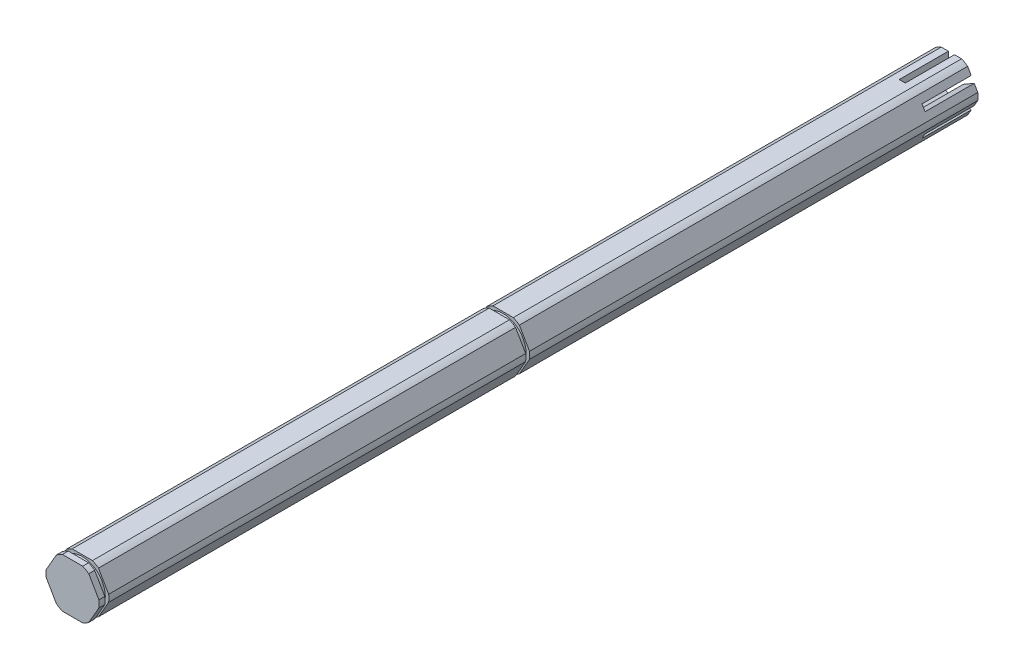
from build123d import *

# Parameters (mm, degrees)
SKETCH2_OUTSIDE_W   = 40.204
SKETCH2_OUTSIDE_H   = 40.204
CUT_EXTRUDE1_DEPTH  = 114.289694924
BOSS_EXTRUDE1_START = 114.3
SKETCH3_R           = 2.4892
BOSS_EXTRUDE1_DEPTH = 114.3
SKETCH4_R           = 3.175
CUT_EXTRUDE2_DEPTH  = 12.7
SKETCH5_W           = 1.5748
SKETCH5_H           = 12.7
CUT_EXTRUDE3_DEPTH  = 12.7
CIRPATTERN1_COUNT   = 6


with BuildPart() as part:
    # Sketch1 → Revolve3 (revolve)
    with BuildSketch(Plane(origin=(0, 0, 0), x_dir=(0, 0, -1), z_dir=(1, 0, 0)), mode=Mode.PRIVATE) as revolve3_sk:
        Polygon((111.252, 7.62), (112.776, 7.62), (112.776, 0), (0, 0), (0, 7.62), (1.524, 7.62), (1.524, 5.9436), (2.5146, 5.9436), (2.5146, 7.62), (110.2614, 7.62), (110.2614, 5.9436), (111.252, 5.9436), align=None)
    revolve(revolve3_sk.sketch.rotate(Axis((0, 0, 0), (0, 0, -1)), 90), axis=Axis((0, 0, 0), (0, 0, -1)))

    # Sketch2 outside → Cut-Extrude1 (cut, through all)
    with BuildSketch(Plane(origin=(0, 0, -112.776), x_dir=(-1, 0, 0), z_dir=(0, 0, -1))):
        Rectangle(SKETCH2_OUTSIDE_W, SKETCH2_OUTSIDE_H)
        with BuildLine():
            Line((6.811131972, 0.902773368), (4.187390656, 5.447226632))
            ThreePointArc((4.187390656, 5.447226632), (3.43535, 5.950200742), (2.623741315, 6.35))
            Line((2.623741315, 6.35), (-2.623741315, 6.35))
            ThreePointArc((-2.623741315, 6.35), (-3.43535, 5.950200742), (-4.187390656, 5.447226632))
            Line((-4.187390656, 5.447226632), (-6.811131972, 0.902773368))
            ThreePointArc((-6.811131972, 0.902773368), (-6.8707, 0), (-6.811131972, -0.902773368))
            Line((-6.811131972, -0.902773368), (-4.187390656, -5.447226632))
            ThreePointArc((-4.187390656, -5.447226632), (-3.43535, -5.950200742), (-2.623741315, -6.35))
            Line((-2.623741315, -6.35), (2.623741315, -6.35))
            ThreePointArc((2.623741315, -6.35), (3.43535, -5.950200742), (4.187390656, -5.447226632))
            Line((4.187390656, -5.447226632), (6.811131972, -0.902773368))
            ThreePointArc((6.811131972, -0.902773368), (6.8707, 0), (6.811131972, 0.902773368))
        make_face(mode=Mode.SUBTRACT)
    extrude(amount=-CUT_EXTRUDE1_DEPTH, mode=Mode.SUBTRACT)

    # Sketch3 → Boss-Extrude1 (add)
    with BuildSketch(Plane(origin=(0, 0, -112.776), x_dir=(-1, 0, 0), z_dir=(0, 0, -1)).offset(BOSS_EXTRUDE1_START)):
        with BuildLine():
            Line((4.187390656, -5.447226632), (6.811131972, -0.902773368))
            ThreePointArc((6.811131972, -0.902773368), (6.8707, 0), (6.811131972, 0.902773368))
            Line((6.811131972, 0.902773368), (4.187390656, 5.447226632))
            ThreePointArc((4.187390656, 5.447226632), (3.43535, 5.950200742), (2.623741315, 6.35))
            Line((2.623741315, 6.35), (-2.623741315, 6.35))
            ThreePointArc((-2.623741315, 6.35), (-3.43535, 5.950200742), (-4.187390656, 5.447226632))
            Line((-4.187390656, 5.447226632), (-6.811131972, 0.902773368))
            ThreePointArc((-6.811131972, 0.902773368), (-6.8707, 0), (-6.811131972, -0.902773368))
            Line((-6.811131972, -0.902773368), (-4.187390656, -5.447226632))
            ThreePointArc((-4.187390656, -5.447226632), (-3.43535, -5.950200742), (-2.623741315, -6.35))
            Line((-2.623741315, -6.35), (2.623741315, -6.35))
            ThreePointArc((2.623741315, -6.35), (3.43535, -5.950200742), (4.187390656, -5.447226632))
        make_face()
        Circle(SKETCH3_R, mode=Mode.SUBTRACT)
    extrude(amount=-BOSS_EXTRUDE1_DEPTH)

    # Sketch4 → Cut-Extrude2 (cut)
    with BuildSketch(Plane(origin=(0, 0, -227.076), x_dir=(-1, 0, 0), z_dir=(0, 0, -1))):
        Circle(SKETCH4_R)
    extrude(amount=-CUT_EXTRUDE2_DEPTH, mode=Mode.SUBTRACT)

    # Sketch5 → Cut-Extrude3 (cut)
    with BuildSketch(Plane(origin=(0, 0, -227.076), x_dir=(-1, 0, 0), z_dir=(0, 0, -1))):
        Rectangle(SKETCH5_W, SKETCH5_H)
    cut_extrude3 = extrude(amount=-CUT_EXTRUDE3_DEPTH, mode=Mode.SUBTRACT)

    # CirPattern1: Cut-Extrude3 ×6 about axis
    cirpattern1_axis = Axis((0, 0, 0), (0, 0, 1))
    for i in range(1, CIRPATTERN1_COUNT):
        add(cut_extrude3.rotate(cirpattern1_axis, i * 360 / CIRPATTERN1_COUNT), mode=Mode.SUBTRACT)


solid = part.part
